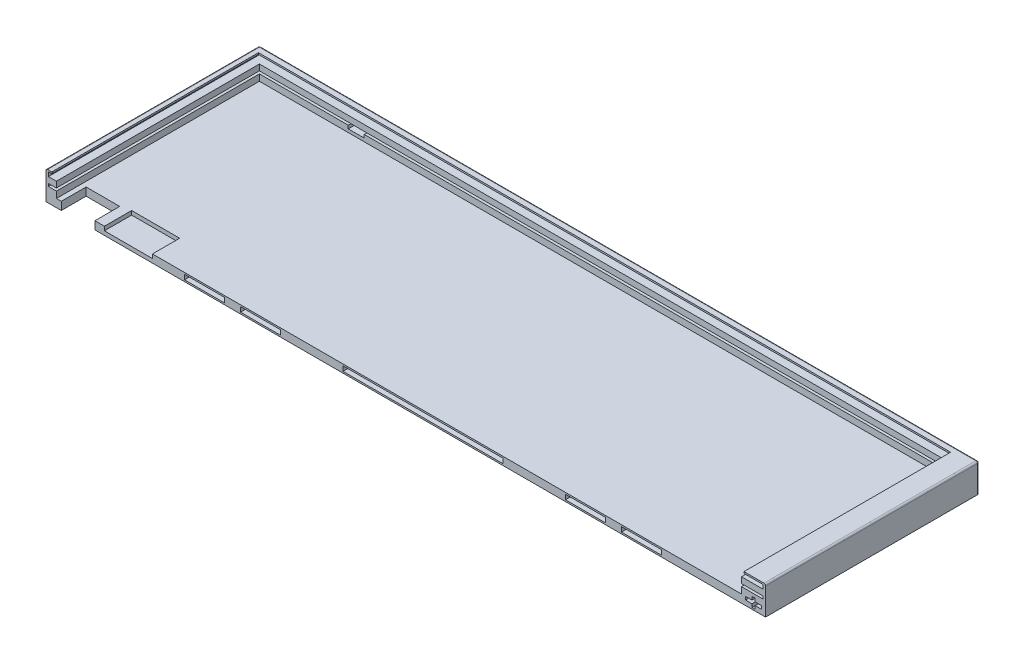
from build123d import *

# Parameters (mm, degrees)
EXTRUDE_1_DEPTH     = 449.532
EXTRUDE_2_DEPTH     = 133.326
EXTRUDE_3_DEPTH     = 133.326
SKETCH_6_W          = 10
SKETCH_6_H          = 2
CUT_EXTRUDE_4_DEPTH = 5
SKETCH_7_W          = 15
SKETCH_7_H          = 2.5
CUT_EXTRUDE_5_DEPTH = 8.5
SKETCH_9_W          = 100
SKETCH_9_H          = 3
SKETCH_9_W_2        = 25
CUT_EXTRUDE_7_DEPTH = 30
SKETCH_10_W         = 21
SKETCH_10_H         = 5
CUT_EXTRUDE_8_DEPTH = 15.5
SKETCH_11_W         = 30
SKETCH_11_H         = 2.5
CUT_EXTRUDE_9_DEPTH = 17
FILLET_1_R          = 1
FILLET_2_R          = 1
FILLET_4_R          = 1


with BuildPart() as part:
    # 草图1 → 凸台-拉伸1 (new body)
    with BuildSketch(Plane(origin=(0, 0, 0), x_dir=(0, 0, -1), z_dir=(1, 0, 0))):
        Polygon((0, 0), (-4.2, 0), (-4.2, -1), (-1.5, -1), (-1.5, -3.55), (-6.5, -3.55), (-6.5, -7.25), (-1.5, -7.25), (-1.5, -8.9), (-6.5, -8.9), (-6.5, -12.9), (-133.326, -12.9), (-133.326, -17.9), (0, -17.9), align=None)
    extrude(amount=EXTRUDE_1_DEPTH)

    # 草图3 → 凸台-拉伸2 (add)
    with BuildSketch(Plane(origin=(0, 0, 0), x_dir=(-1, 0, 0), z_dir=(0, 0, -1))):
        Polygon((-449.532, 0), (-436.032, 0), (-436.032, -1), (-448.032, -1), (-448.032, -3.55), (-434.532, -3.55), (-434.532, -7.25), (-448.032, -7.25), (-448.032, -8.9), (-434.532, -8.9), (-434.532, -17.9), (-449.532, -17.9), align=None)
    extrude(amount=-EXTRUDE_2_DEPTH)

    # 草图4 → 凸台-拉伸3 (add)
    with BuildSketch(Plane(origin=(0, 0, 0), x_dir=(-1, 0, 0), z_dir=(0, 0, -1))):
        Polygon((0, 0), (-3.6, 0), (-3.6, -1), (-1.5, -1), (-1.5, -3.55), (-6.5, -3.55), (-6.5, -7.25), (-1.5, -7.25), (-1.5, -8.9), (-6.5, -8.9), (-6.5, -17.9), (0, -17.9), align=None)
    extrude(amount=-EXTRUDE_3_DEPTH)

    # 草图6 → 切除-拉伸4 (cut)
    with BuildSketch(Plane.XY.offset(6.5)):
        with Locations((67, -9.9)):
            Rectangle(SKETCH_6_W, SKETCH_6_H)
    extrude(amount=-CUT_EXTRUDE_4_DEPTH, mode=Mode.SUBTRACT)

    # 草图7 → 切除-拉伸5 (cut)
    with BuildSketch(Plane.ZY.offset(-434.532)):
        with Locations((23.5, -10.15)):
            Rectangle(SKETCH_7_W, SKETCH_7_H)
    extrude(amount=-CUT_EXTRUDE_5_DEPTH, mode=Mode.SUBTRACT)

    # 草图9 → 切除-拉伸7 (cut)
    with BuildSketch(Plane.XY.offset(133.326)):
        with Locations((235.515, -15.4)):
            Rectangle(SKETCH_9_W, SKETCH_9_H)
        with Locations((99, -15.4)):
            Rectangle(SKETCH_9_W_2, SKETCH_9_H)
        with Locations((337.032, -15.4)):
            Rectangle(SKETCH_9_W_2, SKETCH_9_H)
        with Locations((134, -15.4)):
            Rectangle(SKETCH_9_W_2, SKETCH_9_H)
        with Locations((372.032, -15.4)):
            Rectangle(SKETCH_9_W_2, SKETCH_9_H)
        Polygon((437.032, -12.9), (437.032, -14.9), (441.032, -14.9), (441.032, -16.9), (443.032, -16.9), (443.032, -14.9), (447.032, -14.9), (447.032, -12.9), (443.032, -12.9), (443.032, -10.9), (441.032, -10.9), (441.032, -12.9), align=None)
    extrude(amount=-CUT_EXTRUDE_7_DEPTH, mode=Mode.SUBTRACT)

    # 草图10 → 切除-拉伸8 (cut)
    with BuildSketch(Plane.XY.offset(133.326)):
        with Locations((20.053070751, -15.4)):
            Rectangle(SKETCH_10_W, SKETCH_10_H)
    extrude(amount=-CUT_EXTRUDE_8_DEPTH, mode=Mode.SUBTRACT)

    # 草图11 → 切除-拉伸9 (cut)
    with BuildSketch(Plane.XY.offset(133.326)):
        with Locations((51.5, -14.15)):
            Rectangle(SKETCH_11_W, SKETCH_11_H)
    extrude(amount=-CUT_EXTRUDE_9_DEPTH, mode=Mode.SUBTRACT)

    # 圆角1
    fillet_1_edges = [part.edges().sort_by_distance(p)[0] for p in [
        (0, 0, 66.663),
    ]]
    fillet(fillet_1_edges, radius=FILLET_1_R)

    # 圆角2
    fillet_2_edges = [part.edges().sort_by_distance(p)[0] for p in [
        (0, -9.45, 0),
        (225.266, 0, 0),
        (0.292893219, -0.292893219, 0),
    ]]
    fillet(fillet_2_edges, radius=FILLET_2_R)

    # 圆角4
    fillet_4_edges = [part.edges().sort_by_distance(p)[0] for p in [
        (449.532, 0, 67.163),
        (449.532, -0.292893219, 0.292893219),
        (449.532, -9.45, 0),
    ]]
    fillet(fillet_4_edges, radius=FILLET_4_R)


solid = part.part
